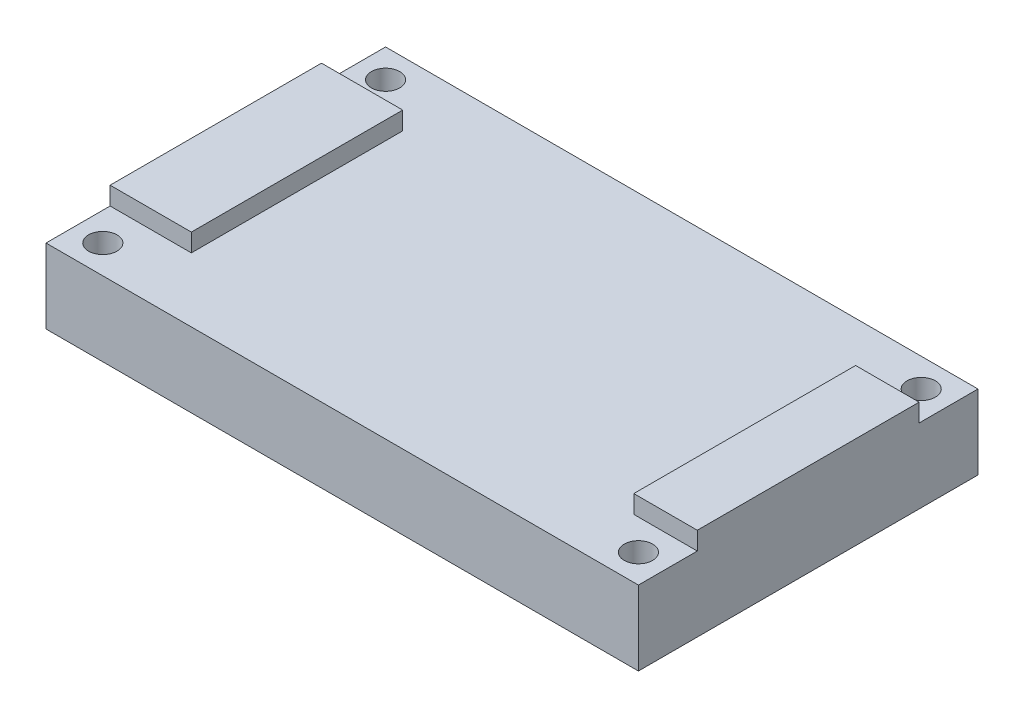
from build123d import *

# Parameters (mm, degrees)
SKETCH1_W               = 41.7195
SKETCH1_H               = 23.9141
BOSS_EXTRUDE1_DEPTH     = 5.2451
CUT_EXTRUDE1_DEPTH      = 25.609170827
CUT_EXTRUDE1_DEPTH_BACK = 25.609170827
SKETCH2_R               = 1
SKETCH3_W               = 4.472619139
SKETCH3_H               = 15.621
SKETCH3_W_2             = 5.720722195
SKETCH3_H_2             = 14.8844
BOSS_EXTRUDE2_DEPTH     = 1.27


with BuildPart() as part:
    # Sketch1 → Boss-Extrude1 (new body)
    with BuildSketch(Plane(origin=(0, 0, 0), x_dir=(1, 0, 0), z_dir=(0, 1, 0))):
        Rectangle(SKETCH1_W, SKETCH1_H)
    extrude(amount=BOSS_EXTRUDE1_DEPTH)

    # Sketch2 → Cut-Extrude1 (cut, two sides: drawn at the far end of the back side and taken through both)
    with BuildSketch(Plane(origin=(0, 5.2451, 0), x_dir=(1, 0, 0), z_dir=(0, 1, 0)).offset(-CUT_EXTRUDE1_DEPTH_BACK)):
        with Locations(Location((-18.85975, 9.95705, 0), (0, 0, 270))):
            Circle(SKETCH2_R)
        with Locations(Location((18.85975, 9.95705, 0), (0, 0, 270))):
            Circle(SKETCH2_R)
        with Locations(Location((18.85975, -9.95705, 0), (0, 0, 270))):
            Circle(SKETCH2_R)
        with Locations(Location((-18.85975, -9.95705, 0), (0, 0, 270))):
            Circle(SKETCH2_R)
    extrude(amount=CUT_EXTRUDE1_DEPTH + CUT_EXTRUDE1_DEPTH_BACK, mode=Mode.SUBTRACT)

    # Sketch3 → Boss-Extrude2 (add)
    with BuildSketch(Plane(origin=(0, 5.2451, 0), x_dir=(1, 0, 0), z_dir=(0, 1, 0))):
        with Locations((18.623440431, 0)):
            Rectangle(SKETCH3_W, SKETCH3_H)
        with Locations((-17.999388903, 0)):
            Rectangle(SKETCH3_W_2, SKETCH3_H_2)
    extrude(amount=BOSS_EXTRUDE2_DEPTH)


solid = part.part
